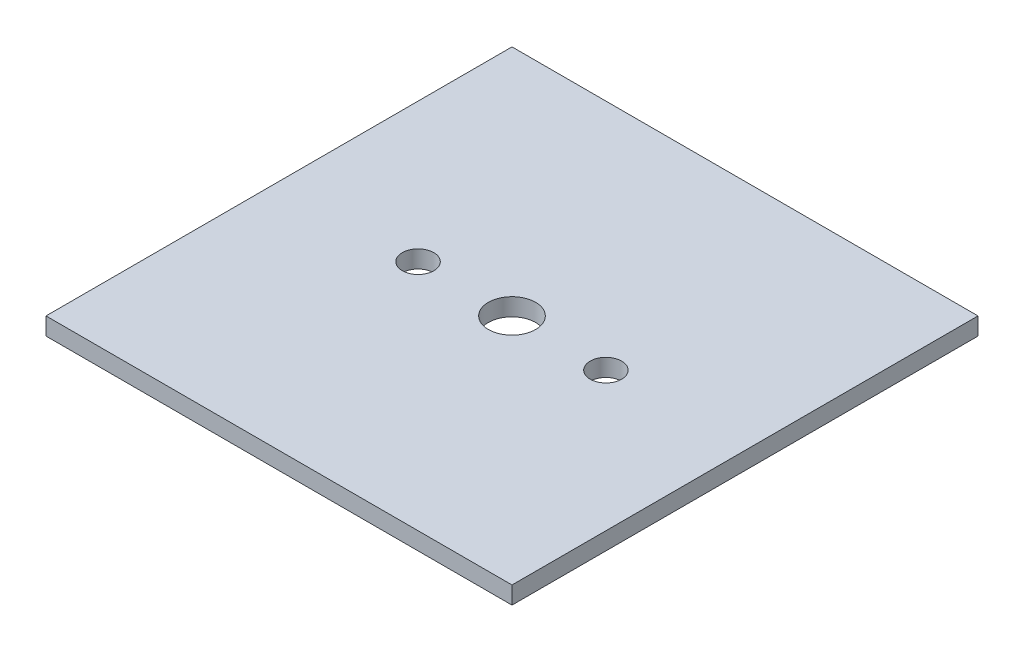
from build123d import *

# Parameters (mm, degrees)
SKETCH_1_W          = 80
SKETCH_1_H          = 80
EXTRUDE_1_DEPTH     = 3
SKETCH_2_R          = 4.05
CUT_EXTRUDE_1_DEPTH = 3
SKETCH_3_R          = 2.7
CUT_EXTRUDE_2_DEPTH = 3


with BuildPart() as part:
    # 草图1 → 凸台-拉伸1 (new body)
    with BuildSketch(Plane(origin=(0, 0, 0), x_dir=(1, 0, 0), z_dir=(0, 1, 0))):
        Rectangle(SKETCH_1_W, SKETCH_1_H)
    extrude(amount=EXTRUDE_1_DEPTH)

    # 草图2 → 切除-拉伸1 (cut)
    with BuildSketch(Plane(origin=(0, 3, 0), x_dir=(1, 0, 0), z_dir=(0, 1, 0))):
        with Locations(Location((0, 0, 0), (0, 0, 270))):
            Circle(SKETCH_2_R)
    extrude(amount=-CUT_EXTRUDE_1_DEPTH, mode=Mode.SUBTRACT)

    # 草图3 → 切除-拉伸2 (cut)
    with BuildSketch(Plane(origin=(0, 3, 0), x_dir=(1, 0, 0), z_dir=(0, 1, 0))):
        with Locations(Location((16.125, 0, 0), (0, 0, 270))):
            Circle(SKETCH_3_R)
        with Locations(Location((-16.125, 0, 0), (0, 0, 270))):
            Circle(SKETCH_3_R)
    extrude(amount=-CUT_EXTRUDE_2_DEPTH, mode=Mode.SUBTRACT)


solid = part.part
